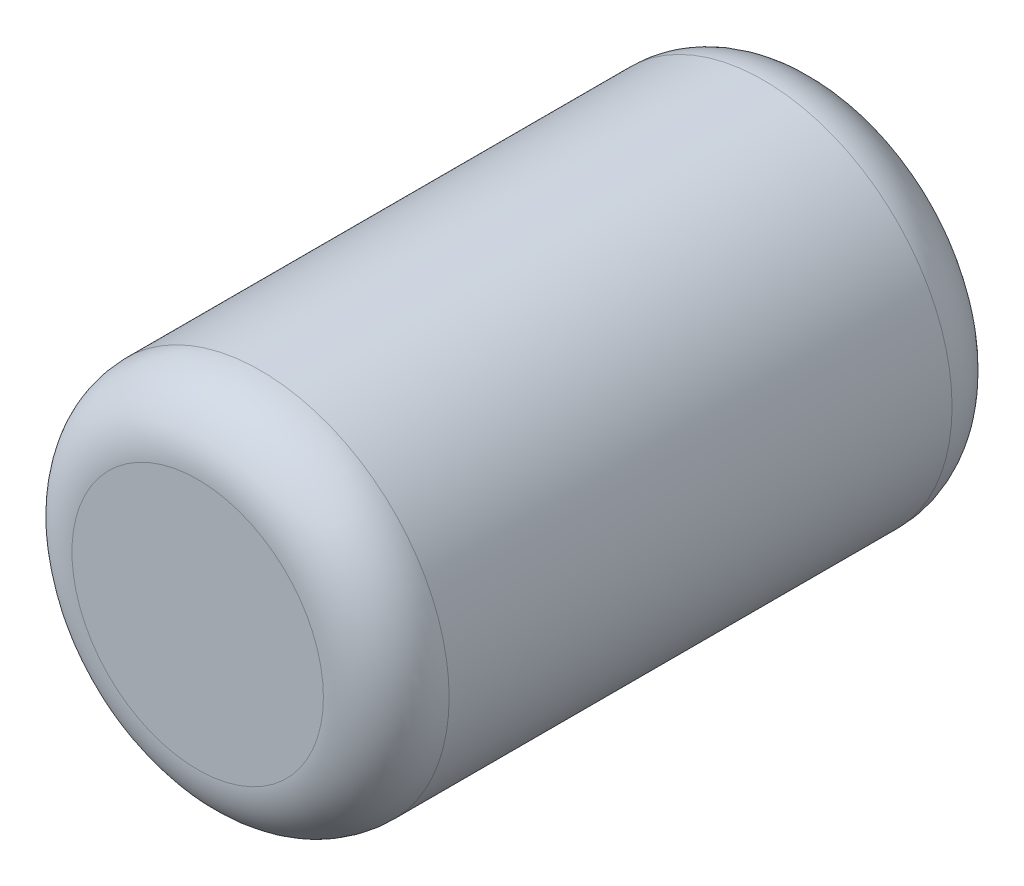
from build123d import *

# Parameters (mm, degrees)
SKETCH2_R           = 9
BOSS_EXTRUDE1_DEPTH = 30
FILLET1_R           = 3


with BuildPart() as part:
    # Sketch2 → Boss-Extrude1 (new body)
    with BuildSketch(Plane.XY):
        Circle(SKETCH2_R)
    extrude(amount=BOSS_EXTRUDE1_DEPTH)

    # Fillet1
    fillet1_edges = [part.edges().sort_by_distance(p)[0] for p in [
        (-9, 0, 0),
        (-9, 0, 30),
    ]]
    fillet(fillet1_edges, radius=FILLET1_R)


solid = part.part
